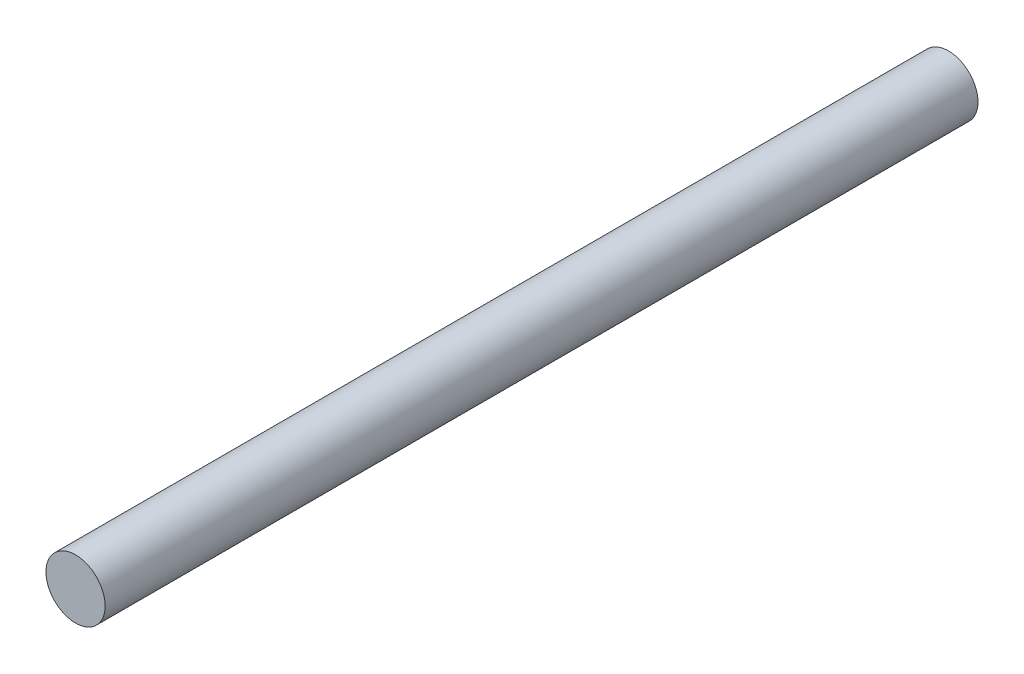
from build123d import *

# Parameters (mm, degrees)
SKETCH1_R           = 3
BOSS_EXTRUDE1_DEPTH = 88.5


with BuildPart() as part:
    # Sketch1 → Boss-Extrude1 (new body)
    with BuildSketch(Plane.XY):
        Circle(SKETCH1_R)
    extrude(amount=BOSS_EXTRUDE1_DEPTH)


solid = part.part
